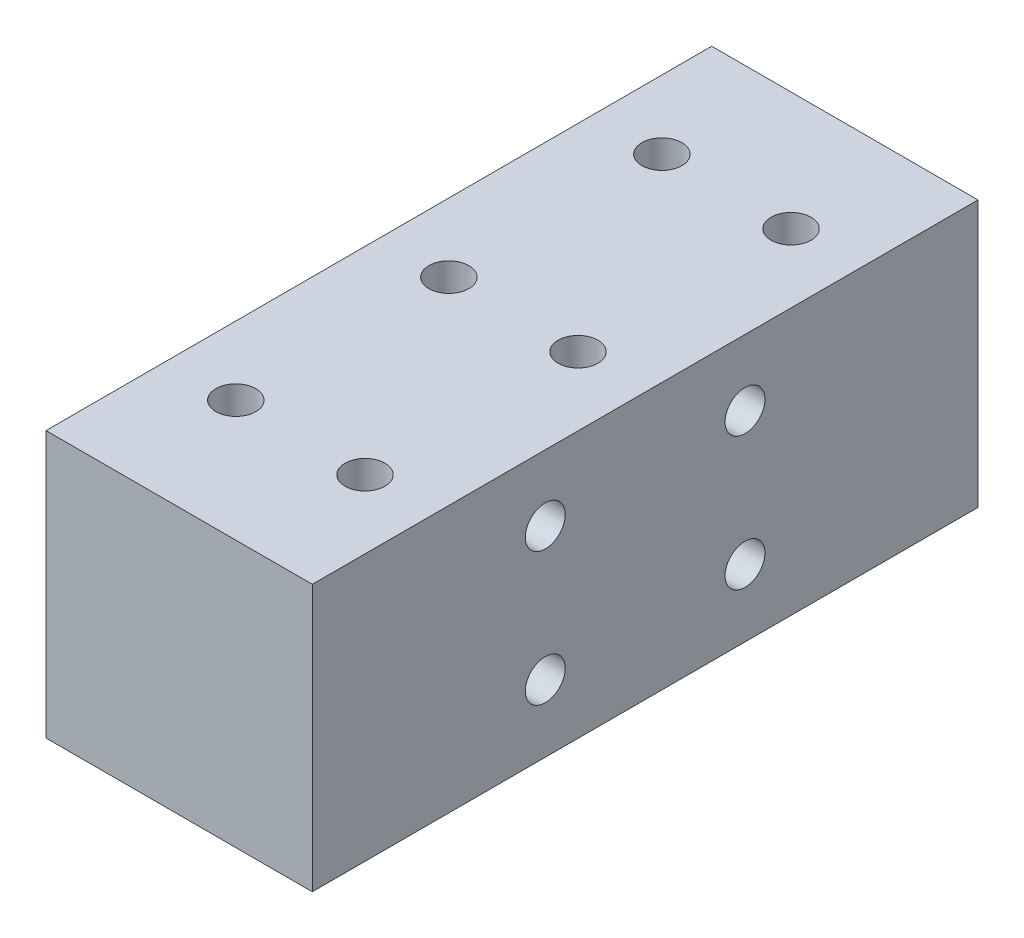
from build123d import *

# Parameters (mm, degrees)
SKETCH_1_W          = 20
SKETCH_1_H          = 20
EXTRUDE_1_DEPTH     = 50
SKETCH_2_R          = 1.5
CUT_EXTRUDE_1_DEPTH = 20
SKETCH_4_R          = 1.5
CUT_EXTRUDE_3_DEPTH = 20


with BuildPart() as part:
    # 草图1 → 凸台-拉伸1 (new body)
    with BuildSketch(Plane.XY):
        Rectangle(SKETCH_1_W, SKETCH_1_H)
    extrude(amount=EXTRUDE_1_DEPTH)

    # 草图2 → 切除-拉伸1 (cut)
    with BuildSketch(Plane(origin=(10, 0, 0), x_dir=(0, 0, -1), z_dir=(1, 0, 0))):
        with Locations((-32.5, 5.05)):
            Circle(SKETCH_2_R)
        with Locations((-17.5, 5.05)):
            Circle(SKETCH_2_R)
        with Locations((-32.5, -4.95)):
            Circle(SKETCH_2_R)
        with Locations((-17.5, -4.95)):
            Circle(SKETCH_2_R)
    extrude(amount=-CUT_EXTRUDE_1_DEPTH, mode=Mode.SUBTRACT)

    # 草图4 → 切除-拉伸3 (cut)
    with BuildSketch(Plane.XZ.offset(10)):
        with Locations(Location((-4.85, 40.893026958, 0), (0, 0, 270))):
            Circle(SKETCH_4_R)
        with Locations(Location((-4.85, 24.893026958, 0), (0, 0, 270))):
            Circle(SKETCH_4_R)
        with Locations(Location((-4.85, 8.893026958, 0), (0, 0, 270))):
            Circle(SKETCH_4_R)
        with Locations(Location((4.85, 8.893026958, 0), (0, 0, 270))):
            Circle(SKETCH_4_R)
        with Locations(Location((4.85, 24.893026958, 0), (0, 0, 270))):
            Circle(SKETCH_4_R)
        with Locations(Location((4.85, 40.893026958, 0), (0, 0, 270))):
            Circle(SKETCH_4_R)
    extrude(amount=-CUT_EXTRUDE_3_DEPTH, mode=Mode.SUBTRACT)


solid = part.part
